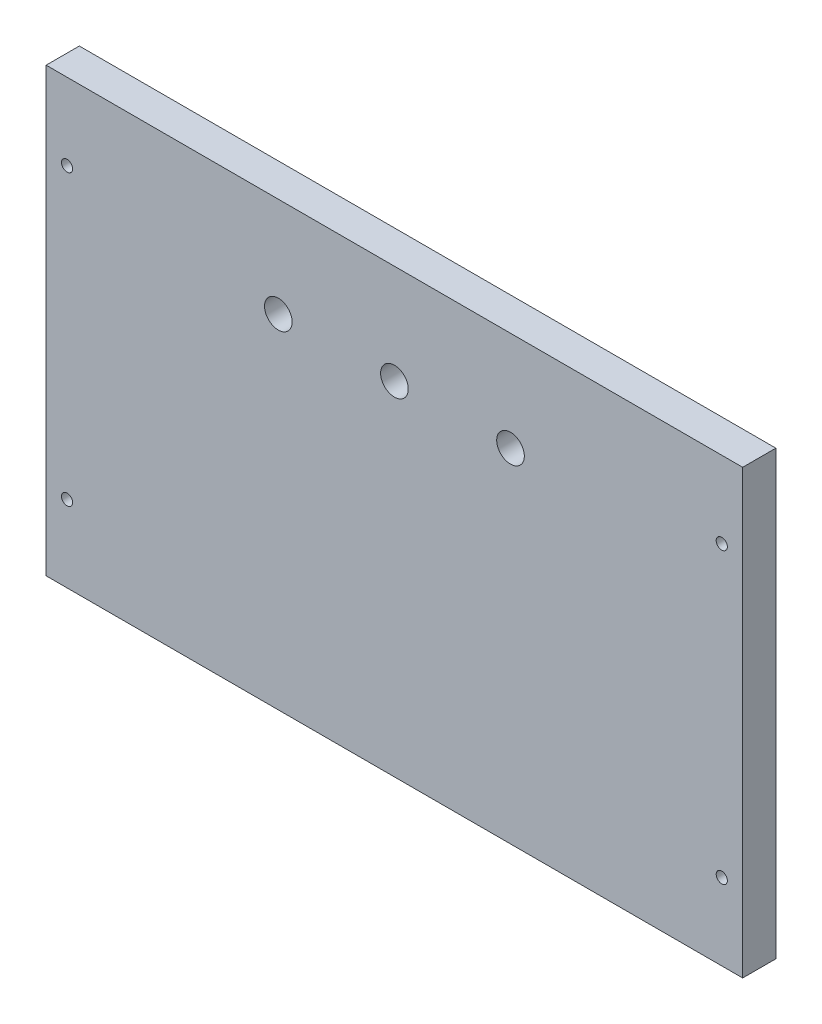
from build123d import *

# Parameters (mm, degrees)
SKETCH1_W           = 200
SKETCH1_H           = 127
SKETCH1_R           = 3.96875
SKETCH1_R_2         = 1.6
BOSS_EXTRUDE1_DEPTH = 9.525


with BuildPart() as part:
    # Sketch1 → Boss-Extrude1 (new body)
    with BuildSketch(Plane.XY):
        with Locations((100, 63.5)):
            Rectangle(SKETCH1_W, SKETCH1_H)
        with Locations(Location((66.666666667, 98.425, 0), (0, 0, 180))):
            Circle(SKETCH1_R, mode=Mode.SUBTRACT)
        with Locations(Location((100, 98.425, 0), (0, 0, 180))):
            Circle(SKETCH1_R, mode=Mode.SUBTRACT)
        with Locations(Location((133.333333333, 98.425, 0), (0, 0, 180))):
            Circle(SKETCH1_R, mode=Mode.SUBTRACT)
        with Locations(Location((6, 105, 0), (0, 0, 180))):
            Circle(SKETCH1_R_2, mode=Mode.SUBTRACT)
        with Locations(Location((6, 22, 0), (0, 0, 180))):
            Circle(SKETCH1_R_2, mode=Mode.SUBTRACT)
        with Locations(Location((194, 22, 0), (0, 0, 180))):
            Circle(SKETCH1_R_2, mode=Mode.SUBTRACT)
        with Locations(Location((194, 105, 0), (0, 0, 180))):
            Circle(SKETCH1_R_2, mode=Mode.SUBTRACT)
    extrude(amount=BOSS_EXTRUDE1_DEPTH)


solid = part.part
